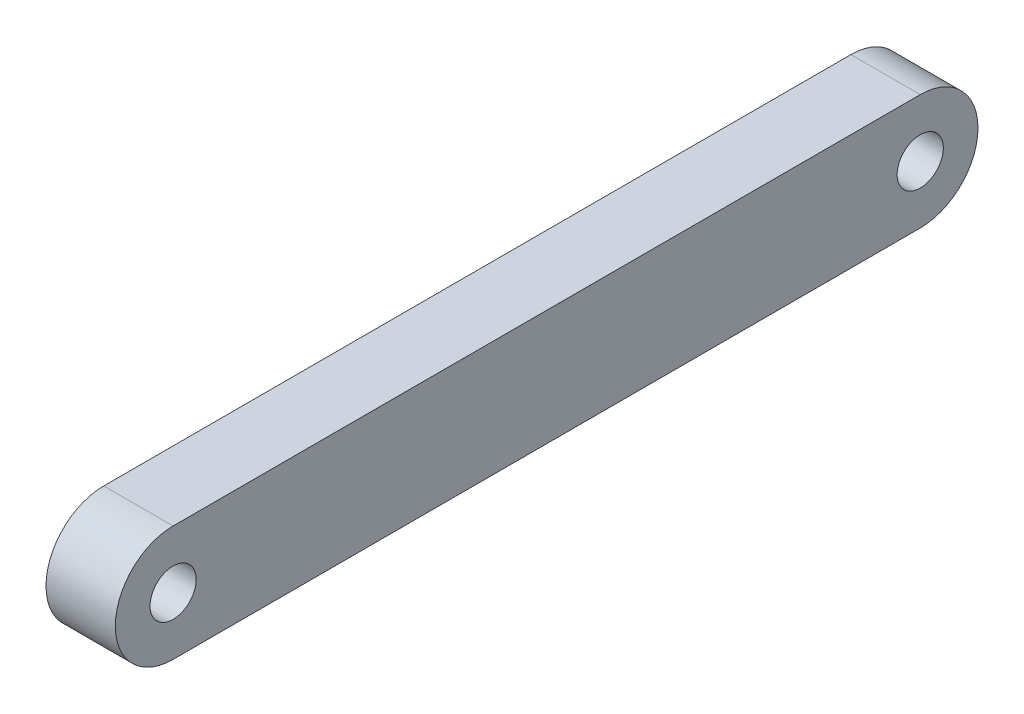
from build123d import *

# Parameters (mm, degrees)
SKETCH1_R           = 2
BOSS_EXTRUDE1_DEPTH = 3


with BuildPart() as part:
    # Sketch1 → Boss-Extrude1 (new, symmetric)
    with BuildSketch(Plane(origin=(0, 0, 0), x_dir=(0, 0, -1), z_dir=(1, 0, 0))):
        with BuildLine():
            Line((-32.325, 5), (32.325, 5))
            ThreePointArc((32.325, 5), (37.325, 0), (32.325, -5))
            Line((32.325, -5), (-32.325, -5))
            ThreePointArc((-32.325, -5), (-37.325, 0), (-32.325, 5))
        make_face()
        with Locations((-32.325, 0)):
            Circle(SKETCH1_R, mode=Mode.SUBTRACT)
        with Locations((32.325, 0)):
            Circle(SKETCH1_R, mode=Mode.SUBTRACT)
    extrude(amount=BOSS_EXTRUDE1_DEPTH, both=True)


solid = part.part
